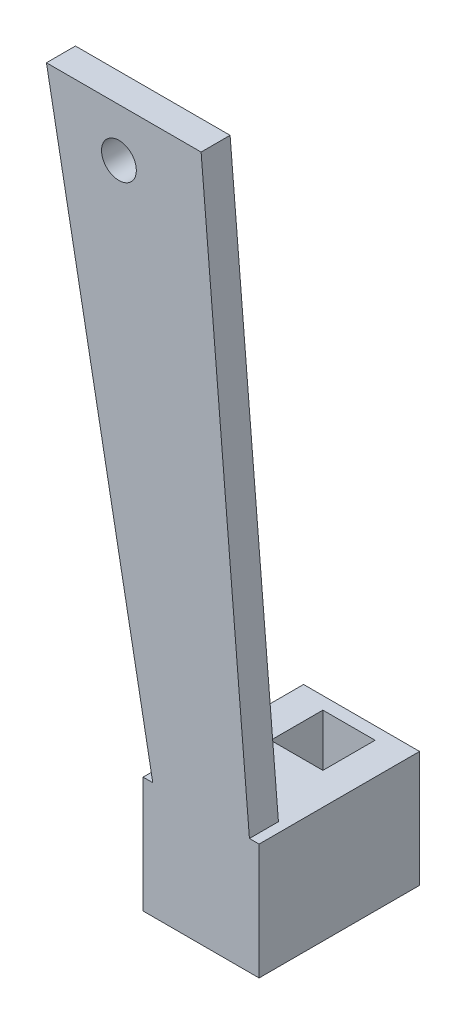
from build123d import *

# Parameters (mm, degrees)
BOSS_EXTRUDE1_START = -4
SKETCH1_W           = 12
SKETCH1_H           = 12
BOSS_EXTRUDE1_DEPTH = 16.6
SKETCH2_W           = 5.4
SKETCH2_H           = 5.4
CUT_EXTRUDE1_DEPTH  = 12
BOSS_EXTRUDE2_START = 9.6
BOSS_EXTRUDE2_DEPTH = 3
SKETCH4_R           = 1.8
CUT_EXTRUDE2_DEPTH  = 25.2


with BuildPart() as part:
    # Sketch1 → Boss-Extrude1 (new body)
    with BuildSketch(Plane.XY.offset(BOSS_EXTRUDE1_START)):
        Rectangle(SKETCH1_W, SKETCH1_H)
    extrude(amount=BOSS_EXTRUDE1_DEPTH)

    # Sketch2 → Cut-Extrude1 (cut, symmetric)
    with BuildSketch(Plane(origin=(0, 0, 0), x_dir=(1, 0, 0), z_dir=(0, 1, 0))):
        Rectangle(SKETCH2_W, SKETCH2_H)
    extrude(amount=CUT_EXTRUDE1_DEPTH, both=True, mode=Mode.SUBTRACT)

    # Sketch3 → Boss-Extrude2 (add)
    with BuildSketch(Plane.XY.offset(BOSS_EXTRUDE2_START)):
        Polygon((-5, 6), (5, 6), (0, 65), (-16, 65), align=None)
    extrude(amount=BOSS_EXTRUDE2_DEPTH)

    # Sketch4 → Cut-Extrude2 (cut, symmetric)
    with BuildSketch(Plane.XY):
        with Locations((-8.5, 60)):
            Circle(SKETCH4_R)
    extrude(amount=CUT_EXTRUDE2_DEPTH, both=True, mode=Mode.SUBTRACT)


solid = part.part
